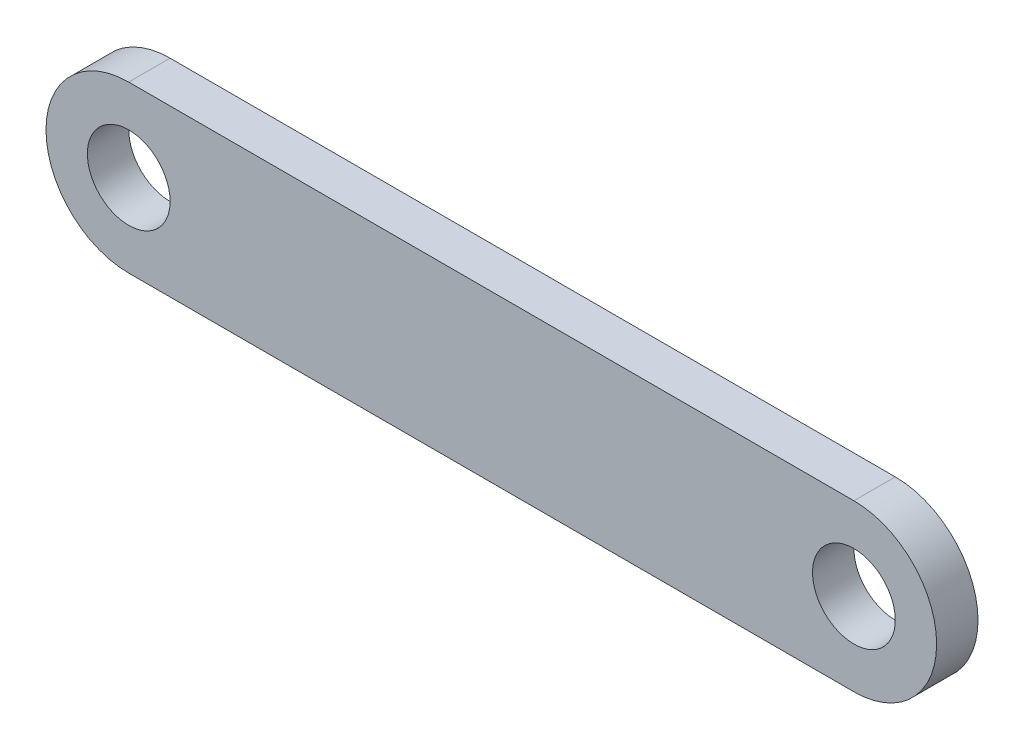
from build123d import *

# Parameters (mm, degrees)
SKETCH1_R      = 1
EXTRUDE1_DEPTH = 1


with BuildPart() as part:
    # Sketch1 → Extrude1 (new body)
    with BuildSketch(Plane.XY):
        with BuildLine():
            ThreePointArc((0, 2), (-2, 0), (0, -2))
            Line((0, -2), (17.53, -2))
            ThreePointArc((17.53, -2), (19.53, 0), (17.53, 2))
            Line((17.53, 2), (0, 2))
        make_face()
        Circle(SKETCH1_R, mode=Mode.SUBTRACT)
        with Locations((17.53, 0)):
            Circle(SKETCH1_R, mode=Mode.SUBTRACT)
    extrude(amount=-EXTRUDE1_DEPTH)


solid = part.part
